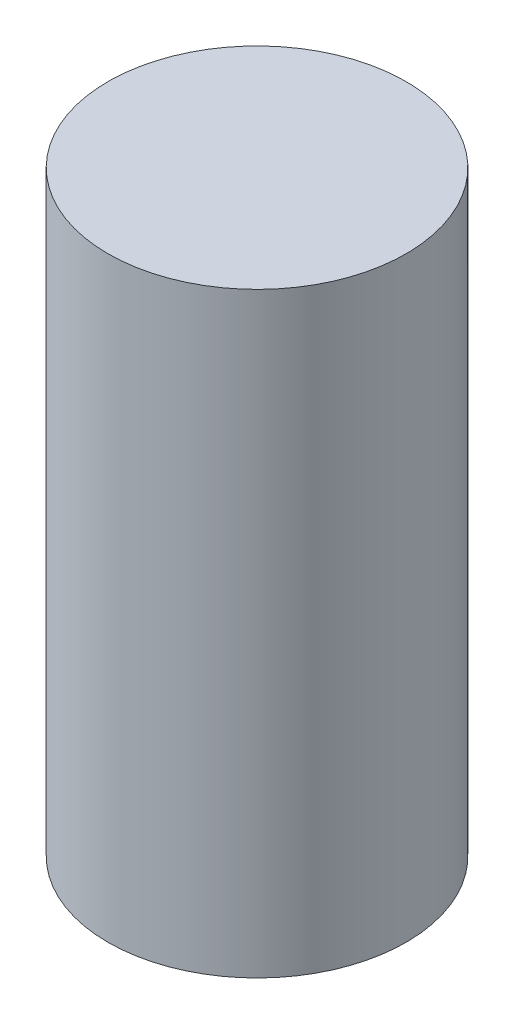
from build123d import *

# Parameters (mm, degrees)
SKETCH1_R           = 2.2225
BOSS_EXTRUDE1_DEPTH = 8.89


with BuildPart() as part:
    # Sketch1 → Boss-Extrude1 (new body)
    with BuildSketch(Plane(origin=(0, 0, 0), x_dir=(1, 0, 0), z_dir=(0, 1, 0))):
        with Locations(Location((0, 0, 0), (0, 0, 270))):
            Circle(SKETCH1_R)
    extrude(amount=BOSS_EXTRUDE1_DEPTH)


solid = part.part
